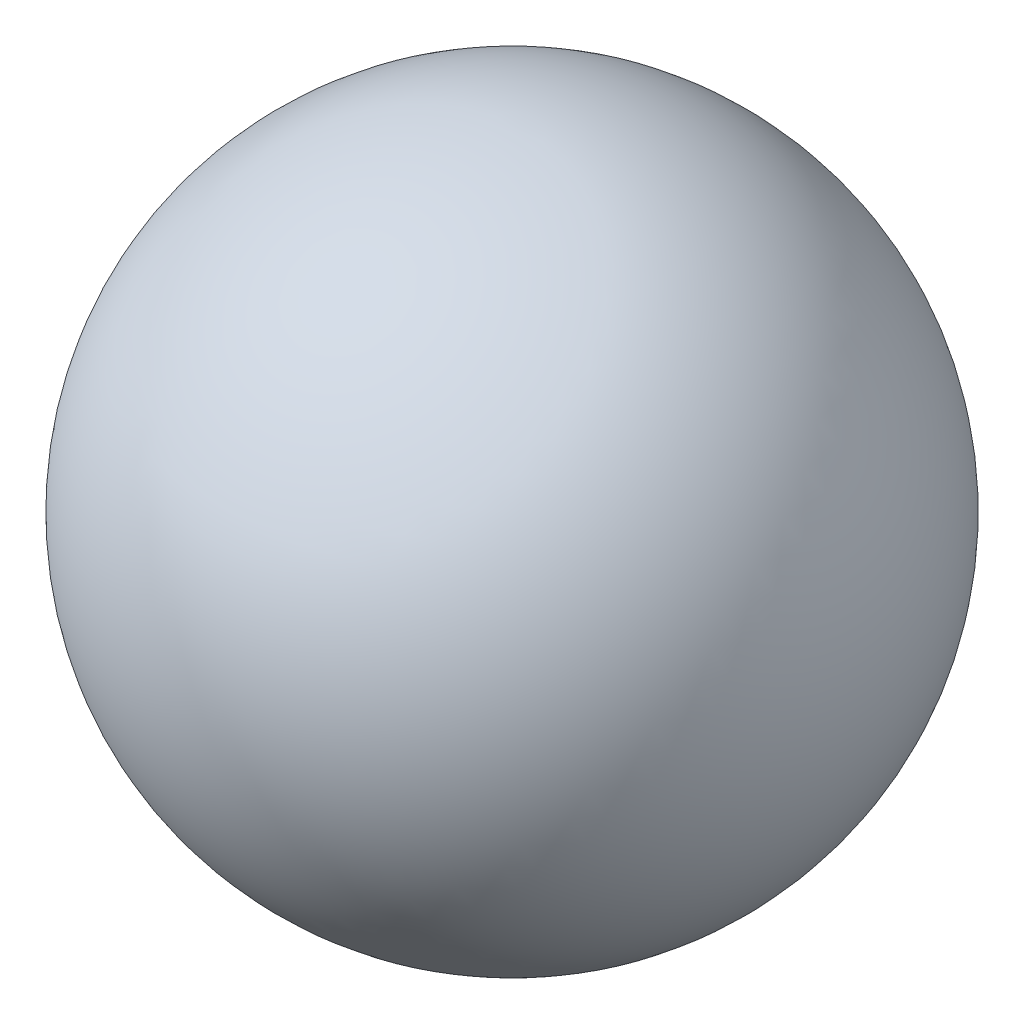
from build123d import *


with BuildPart() as part:
    # 草图1 → 旋转4 (revolve)
    with BuildSketch(Plane.XY):
        with BuildLine():
            Line((0, 37.5), (0, -37.5))
            ThreePointArc((0, -37.5), (-37.5, 0), (0, 37.5))
        make_face()
    revolve(axis=Axis((0, 37.5, 0), (0, -1, 0)))


solid = part.part
